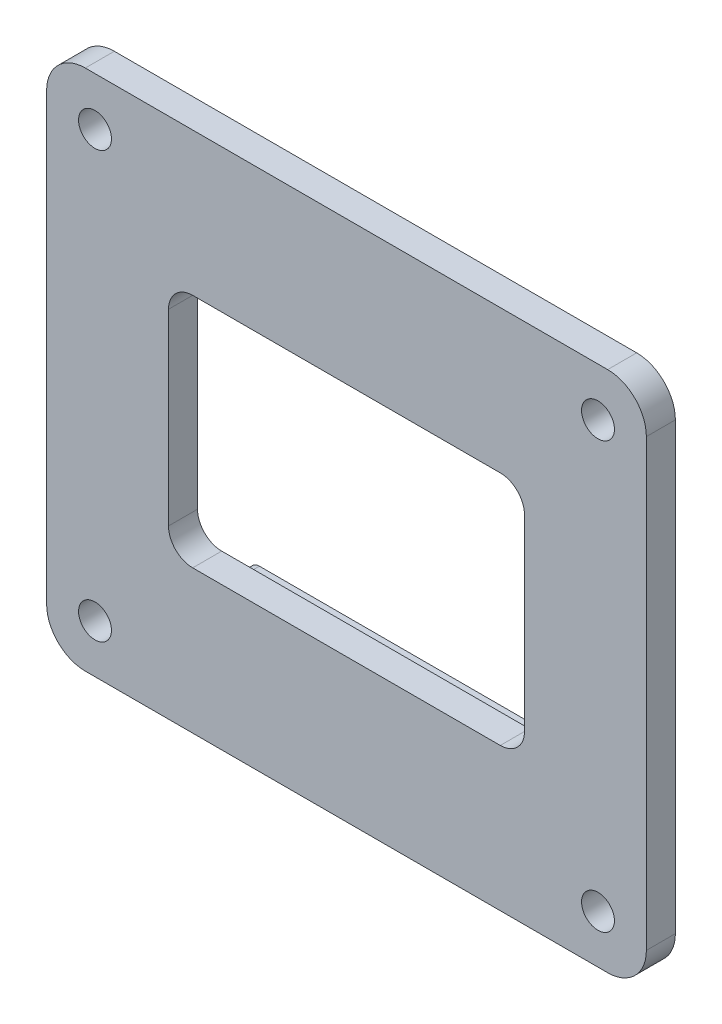
from build123d import *

# Parameters (mm, degrees)
OUTER_CLAMP_COVER_62X54X3_SKETCH_R = 1.7
OUTER_CLAMP_COVER_62X54X3_DEPTH    = 3
TWO_CASE_RETAINING_FEET_START      = -2
TWO_CASE_RETAINING_FEET_DEPTH      = 2


with BuildPart() as part:
    # Outer_clamp_cover_62x54x3_Sketch → Outer_clamp_cover_62x54x3 (new body)
    with BuildSketch(Plane.XY):
        with BuildLine():
            Line((-27, -27), (27, -27))
            ThreePointArc((27, -27), (29.828427125, -25.828427125), (31, -23))
            Line((31, -23), (31, 23))
            ThreePointArc((31, 23), (29.828427125, 25.828427125), (27, 27))
            Line((27, 27), (-27, 27))
            ThreePointArc((-27, 27), (-29.828427125, 25.828427125), (-31, 23))
            Line((-31, 23), (-31, -23))
            ThreePointArc((-31, -23), (-29.828427125, -25.828427125), (-27, -27))
        make_face()
        with Locations((-26, -22)):
            Circle(OUTER_CLAMP_COVER_62X54X3_SKETCH_R, mode=Mode.SUBTRACT)
        with Locations((-26, 22)):
            Circle(OUTER_CLAMP_COVER_62X54X3_SKETCH_R, mode=Mode.SUBTRACT)
        with Locations((26, -22)):
            Circle(OUTER_CLAMP_COVER_62X54X3_SKETCH_R, mode=Mode.SUBTRACT)
        with Locations((26, 22)):
            Circle(OUTER_CLAMP_COVER_62X54X3_SKETCH_R, mode=Mode.SUBTRACT)
        with BuildLine():
            Line((-15.9, -12.2), (15.9, -12.2))
            ThreePointArc((15.9, -12.2), (17.667766953, -11.467766953), (18.4, -9.7))
            Line((18.4, -9.7), (18.4, 9.7))
            ThreePointArc((18.4, 9.7), (17.667766953, 11.467766953), (15.9, 12.2))
            Line((15.9, 12.2), (-15.9, 12.2))
            ThreePointArc((-15.9, 12.2), (-17.667766953, 11.467766953), (-18.4, 9.7))
            Line((-18.4, 9.7), (-18.4, -9.7))
            ThreePointArc((-18.4, -9.7), (-17.667766953, -11.467766953), (-15.9, -12.2))
        make_face(mode=Mode.SUBTRACT)
    extrude(amount=OUTER_CLAMP_COVER_62X54X3_DEPTH)

    # Two_case_retaining_feet_Sketch → Two_case_retaining_feet (add)
    with BuildSketch(Plane.XY.offset(TWO_CASE_RETAINING_FEET_START)):
        with BuildLine():
            Line((-14, -17.5), (14, -17.5))
            ThreePointArc((14, -17.5), (14.707106781, -17.207106781), (15, -16.5))
            Line((15, -16.5), (15, -14.6))
            ThreePointArc((15, -14.6), (14.707106781, -13.892893219), (14, -13.6))
            Line((14, -13.6), (-14, -13.6))
            ThreePointArc((-14, -13.6), (-14.707106781, -13.892893219), (-15, -14.6))
            Line((-15, -14.6), (-15, -16.5))
            ThreePointArc((-15, -16.5), (-14.707106781, -17.207106781), (-14, -17.5))
        make_face()
        with BuildLine():
            Line((-14, 13.6), (14, 13.6))
            ThreePointArc((14, 13.6), (14.707106781, 13.892893219), (15, 14.6))
            Line((15, 14.6), (15, 16.5))
            ThreePointArc((15, 16.5), (14.707106781, 17.207106781), (14, 17.5))
            Line((14, 17.5), (-14, 17.5))
            ThreePointArc((-14, 17.5), (-14.707106781, 17.207106781), (-15, 16.5))
            Line((-15, 16.5), (-15, 14.6))
            ThreePointArc((-15, 14.6), (-14.707106781, 13.892893219), (-14, 13.6))
        make_face()
    extrude(amount=TWO_CASE_RETAINING_FEET_DEPTH)


solid = part.part
